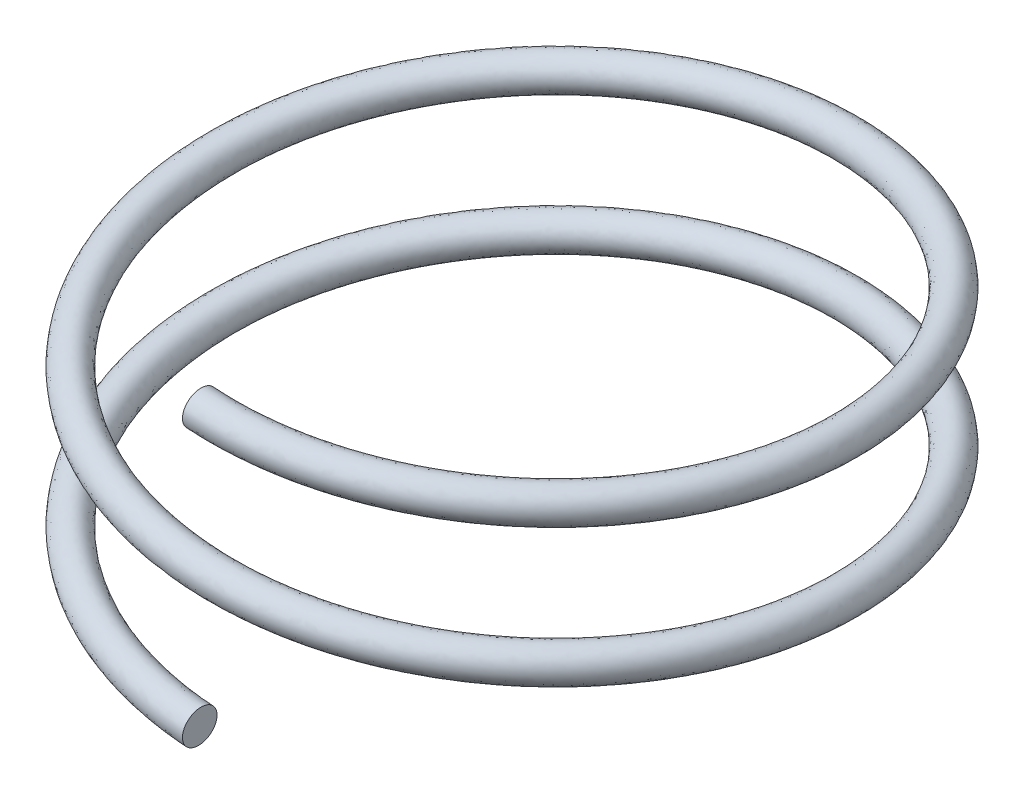
from build123d import *

# Parameters (mm, degrees)
SWEEP_1_PITCH  = 20
SWEEP_1_HEIGHT = 40
SWEEP_1_RADIUS = 45
SKETCH_3_R     = 2.5


with BuildPart() as part:
    # По траектории1: sweep along a helix
    with BuildLine() as sweep_1_path:
        Helix(SWEEP_1_PITCH, SWEEP_1_HEIGHT, SWEEP_1_RADIUS, center=(0, 0, 0), direction=(0, 1, 0), lefthand=True)
    # Эскиз3 → По траектории1 (sweep)
    with BuildSketch(Plane(origin=(0, 0, 45), x_dir=(0, 0, 1), z_dir=(-0.9975075915916564, 0.07055922843266814, 0))):
        with Locations((0.196998306, 0)):
            Circle(SKETCH_3_R)
    sweep(path=sweep_1_path.line, is_frenet=True)


solid = part.part
